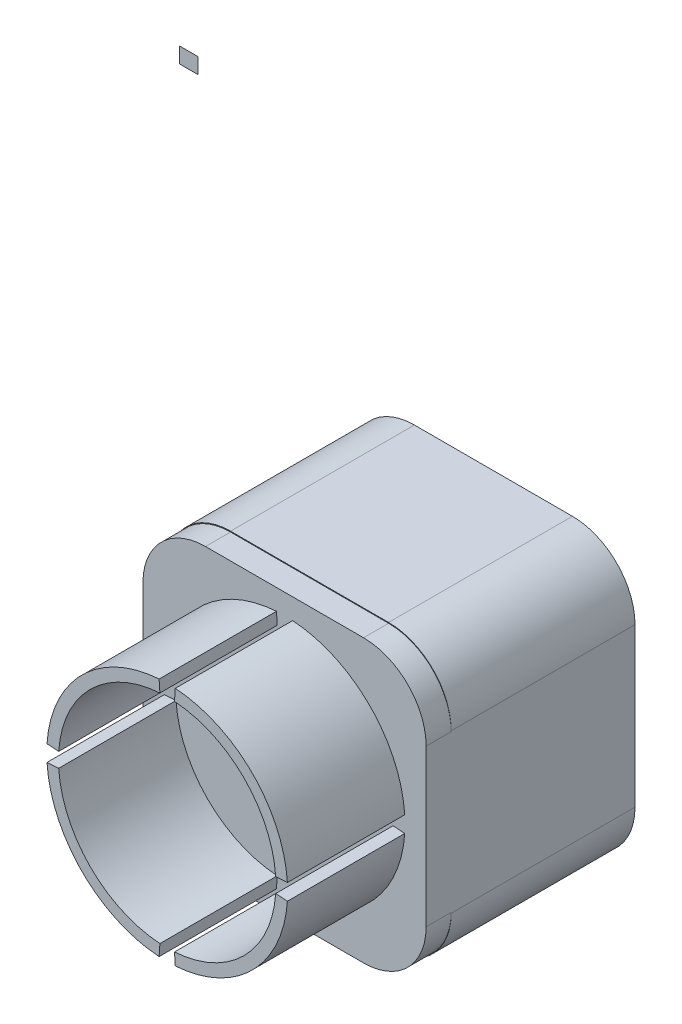
from build123d import *

# Parameters (mm, degrees)
SKETCH1_W           = 1.158652837
SKETCH1_H           = 0.996663238
BOSS_EXTRUDE1_DEPTH = 0.0005
BOSS_EXTRUDE2_DEPTH = 11.74993
BOSS_EXTRUDE3_DEPTH = 1.6
SKETCH4_R           = 7.7
BOSS_EXTRUDE4_DEPTH = 7.5
SKETCH5_R           = 6.95
CUT_EXTRUDE1_DEPTH  = 7.5
CUT_EXTRUDE2_DEPTH  = 7.5
CIRPATTERN1_COUNT   = 4


with BuildPart() as part:
    # Sketch1 → Boss-Extrude1 (new body)
    with BuildSketch(Plane.XY):
        with Locations((-19.474752995, 22.028941101)):
            Rectangle(SKETCH1_W, SKETCH1_H)
    extrude(amount=BOSS_EXTRUDE1_DEPTH)


with BuildPart() as body_2:
    # Sketch2 → Boss-Extrude2 (new body)
    with BuildSketch(Plane.XY):
        with BuildLine():
            Line((-5.05, 9.05), (5.05, 9.05))
            ThreePointArc((5.05, 9.05), (7.878427125, 7.878427125), (9.05, 5.05))
            Line((9.05, 5.05), (9.05, -5.05))
            ThreePointArc((9.05, -5.05), (7.878427125, -7.878427125), (5.05, -9.05))
            Line((5.05, -9.05), (-5.05, -9.05))
            ThreePointArc((-5.05, -9.05), (-7.878427125, -7.878427125), (-9.05, -5.05))
            Line((-9.05, -5.05), (-9.05, 5.05))
            ThreePointArc((-9.05, 5.05), (-7.878427125, 7.878427125), (-5.05, 9.05))
        make_face()
        with BuildLine():
            Line((-2.579374981, 1.43), (2.579374981, 1.43))
            ThreePointArc((2.579374981, 1.43), (2.949249821, 0.000883851), (2.580231621, -1.428453735))
            Line((2.580231621, -1.428453735), (-2.578517414, -1.431545751))
            ThreePointArc((-2.578517414, -1.431545751), (-2.949249821, -0.000883851), (-2.579374981, 1.43))
        make_face(mode=Mode.SUBTRACT)
    extrude(amount=BOSS_EXTRUDE2_DEPTH)

    # Sketch3 → Boss-Extrude3 (add)
    with BuildSketch(Plane.XY.offset(11.74993)):
        with BuildLine():
            Line((-5.05, 9.000108401), (5.05, 9.000108401))
            ThreePointArc((5.05, 9.000108401), (7.878427125, 7.828535526), (9.05, 5.000108401))
            Line((9.05, 5.000108401), (9.05, -5.000108401))
            ThreePointArc((9.05, -5.000108401), (7.878427125, -7.828535526), (5.05, -9.000108401))
            Line((5.05, -9.000108401), (-5.05, -9.000108401))
            ThreePointArc((-5.05, -9.000108401), (-7.878427125, -7.828535526), (-9.05, -5.000108401))
            Line((-9.05, -5.000108401), (-9.05, 5.000108401))
            ThreePointArc((-9.05, 5.000108401), (-7.878427125, 7.828535526), (-5.05, 9.000108401))
        make_face()
    extrude(amount=BOSS_EXTRUDE3_DEPTH)

    # Sketch4 → Boss-Extrude4 (add)
    with BuildSketch(Plane.XY.offset(13.34993)):
        Circle(SKETCH4_R)
    extrude(amount=BOSS_EXTRUDE4_DEPTH)

    # Sketch5 → Cut-Extrude1 (cut)
    with BuildSketch(Plane.XY.offset(13.34993)):
        Circle(SKETCH5_R)
    extrude(amount=CUT_EXTRUDE1_DEPTH, mode=Mode.SUBTRACT)

    # Sketch11 → Cut-Extrude2 (cut)
    with BuildSketch(Plane.XY.offset(13.34993)):
        Polygon((0, 8.183776361), (-0.55, 8.183776361), (0, 0), (0.55, 8.183776361), align=None)
    cut_extrude2 = extrude(amount=CUT_EXTRUDE2_DEPTH, mode=Mode.SUBTRACT)

    # CirPattern1: Cut-Extrude2 ×4 about axis
    cirpattern1_axis = Axis((0, 0, 20.84993), (0, 0, -1))
    for i in range(1, CIRPATTERN1_COUNT):
        add(cut_extrude2.rotate(cirpattern1_axis, i * 360 / CIRPATTERN1_COUNT), mode=Mode.SUBTRACT)


solid = Compound([part.part, body_2.part])
